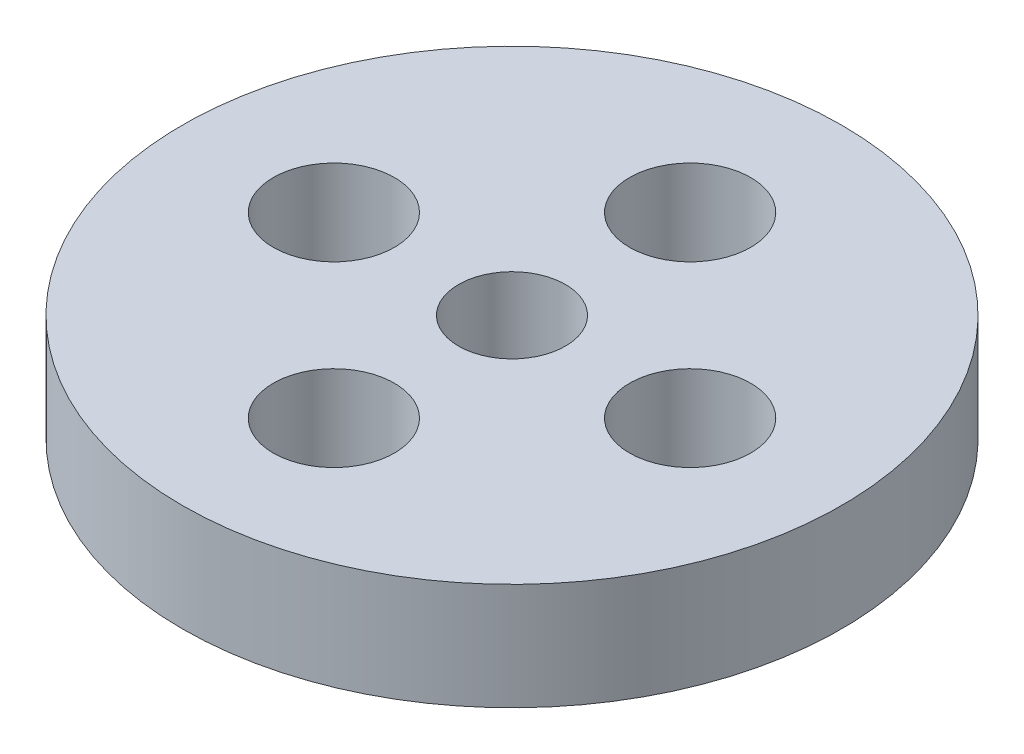
from build123d import *

# Parameters (mm, degrees)
SKETCH1_R           = 9.25
SKETCH1_R_2         = 1.7
SKETCH1_R_3         = 1.5
BOSS_EXTRUDE1_DEPTH = 3


with BuildPart() as part:
    # Sketch1 → Boss-Extrude1 (new body)
    with BuildSketch(Plane(origin=(0, 0, 0), x_dir=(1, 0, 0), z_dir=(0, 1, 0))):
        with Locations(Location((0, 0, 0), (0, 0, 270))):
            Circle(SKETCH1_R)
        with Locations(Location((-5, 0, 0), (0, 0, 270))):
            Circle(SKETCH1_R_2, mode=Mode.SUBTRACT)
        with Locations(Location((0, 5, 0), (0, 0, 270))):
            Circle(SKETCH1_R_2, mode=Mode.SUBTRACT)
        with Locations(Location((5, 0, 0), (0, 0, 270))):
            Circle(SKETCH1_R_2, mode=Mode.SUBTRACT)
        with Locations(Location((0, -5, 0), (0, 0, 270))):
            Circle(SKETCH1_R_2, mode=Mode.SUBTRACT)
        with Locations(Location((0, 0, 0), (0, 0, 270))):
            Circle(SKETCH1_R_3, mode=Mode.SUBTRACT)
    extrude(amount=BOSS_EXTRUDE1_DEPTH)


solid = part.part
